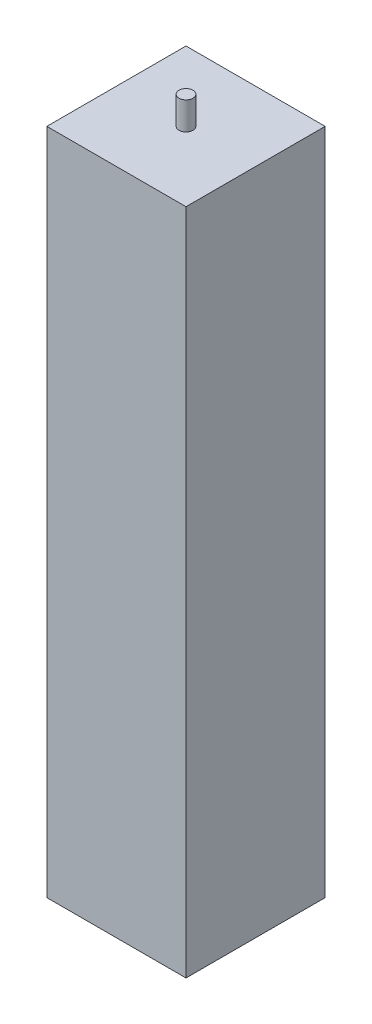
from build123d import *

# Parameters (mm, degrees)
SKETCH_1_W           = 10
SKETCH_1_H           = 48
EXTRUDE_1_DEPTH      = 10
EXTRUDE_2_DEPTH      = 2
EXTRUDE_2_DEPTH_BACK = 49.5
SKETCH_2_R           = 0.5


with BuildPart() as part:
    # 草图1 → 凸台-拉伸1 (new body)
    with BuildSketch(Plane.XY):
        Rectangle(SKETCH_1_W, SKETCH_1_H)
    extrude(amount=EXTRUDE_1_DEPTH)

    # 草图2 → 凸台-拉伸2 (add, two sides: drawn at the far end of the back side and taken through both)
    with BuildSketch(Plane(origin=(0, 24, 0), x_dir=(1, 0, 0), z_dir=(0, 1, 0)).offset(-EXTRUDE_2_DEPTH_BACK)):
        with Locations(Location((0, -5, 0), (0, 0, 270))):
            Circle(SKETCH_2_R)
    extrude(amount=EXTRUDE_2_DEPTH + EXTRUDE_2_DEPTH_BACK)


solid = part.part
